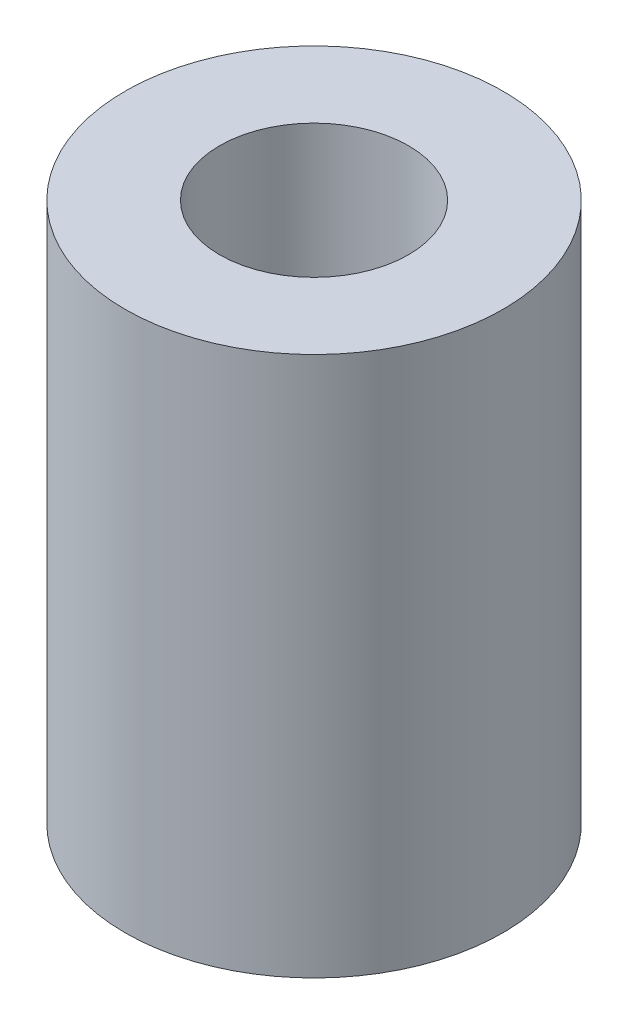
from build123d import *

# Parameters (mm, degrees)
SKETCH1_R           = 3.5
SKETCH1_R_2         = 1.75
BOSS_EXTRUDE1_DEPTH = 10


with BuildPart() as part:
    # Sketch1 → Boss-Extrude1 (new body)
    with BuildSketch(Plane(origin=(0, 0, 0), x_dir=(1, 0, 0), z_dir=(0, 1, 0))):
        with Locations(Location((0, 0, 0), (0, 0, 270))):
            Circle(SKETCH1_R)
        with Locations(Location((0, 0, 0), (0, 0, 270))):
            Circle(SKETCH1_R_2, mode=Mode.SUBTRACT)
    extrude(amount=BOSS_EXTRUDE1_DEPTH)


solid = part.part
